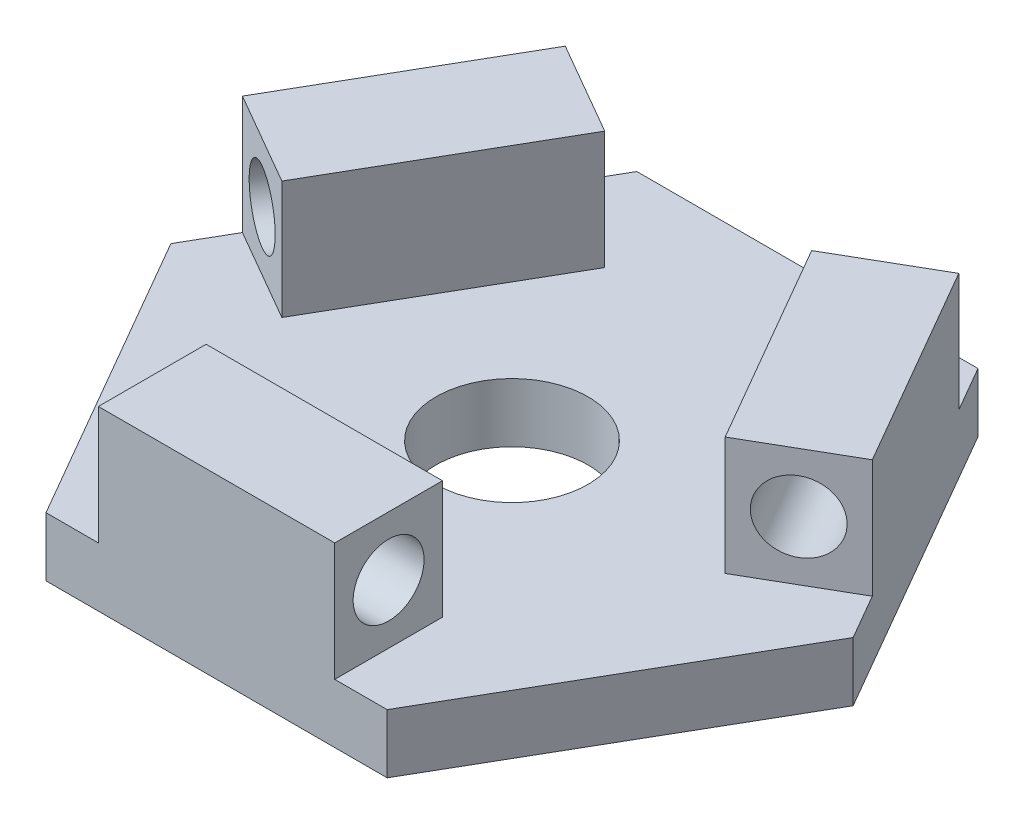
from build123d import *

# Parameters (mm, degrees)
BOSS_EXTRUDE1_DEPTH = 5
SKETCH4_R           = 6.430810597
CUT_EXTRUDE2_DEPTH  = 10
SKETCH2_W           = 20
SKETCH2_H           = 9.116342764
BOSS_EXTRUDE2_DEPTH = 10
SKETCH3_R           = 3
CUT_EXTRUDE1_DEPTH  = 49.586866564
CIRPATTERN1_COUNT   = 3


with BuildPart() as part:
    # Sketch1 → Boss-Extrude1 (new body)
    with BuildSketch(Plane(origin=(0, 0, 0), x_dir=(1, 0, 0), z_dir=(0, 1, 0))):
        Polygon((14.43375673, 25), (-14.43375673, 25), (-28.867513459, 0), (-14.43375673, -25), (14.43375673, -25), (28.867513459, 0), align=None)
    extrude(amount=BOSS_EXTRUDE1_DEPTH)

    # Sketch4 → Cut-Extrude2 (cut)
    with BuildSketch(Plane(origin=(0, 5, 0), x_dir=(1, 0, 0), z_dir=(0, 1, 0))):
        with Locations(Location((0, 0, 0), (0, 0, 270))):
            Circle(SKETCH4_R)
    extrude(amount=-CUT_EXTRUDE2_DEPTH, mode=Mode.SUBTRACT)

    # Sketch2 → Boss-Extrude2 (add)
    with BuildSketch(Plane(origin=(0, 5, 0), x_dir=(1, 0, 0), z_dir=(0, 1, 0))):
        with Locations((0, -20.441828618)):
            Rectangle(SKETCH2_W, SKETCH2_H)
    boss_extrude2 = extrude(amount=BOSS_EXTRUDE2_DEPTH)

    # Sketch3 → Cut-Extrude1 (cut, through all)
    with BuildSketch(Plane(origin=(10, 0, 0), x_dir=(0, 0, -1), z_dir=(1, 0, 0))):
        with Locations((-20.441828618, 10)):
            Circle(SKETCH3_R)
    cut_extrude1 = extrude(amount=-CUT_EXTRUDE1_DEPTH, mode=Mode.SUBTRACT)

    # CirPattern1: Boss-Extrude2, Cut-Extrude1 ×3 about axis
    cirpattern1_axis = Axis((0, 0, 0), (0, 1, 0))
    add([boss_extrude2.rotate(cirpattern1_axis, i * 360 / CIRPATTERN1_COUNT) for i in range(1, CIRPATTERN1_COUNT)])
    add([cut_extrude1.rotate(cirpattern1_axis, i * 360 / CIRPATTERN1_COUNT) for i in range(1, CIRPATTERN1_COUNT)], mode=Mode.SUBTRACT)


solid = part.part
